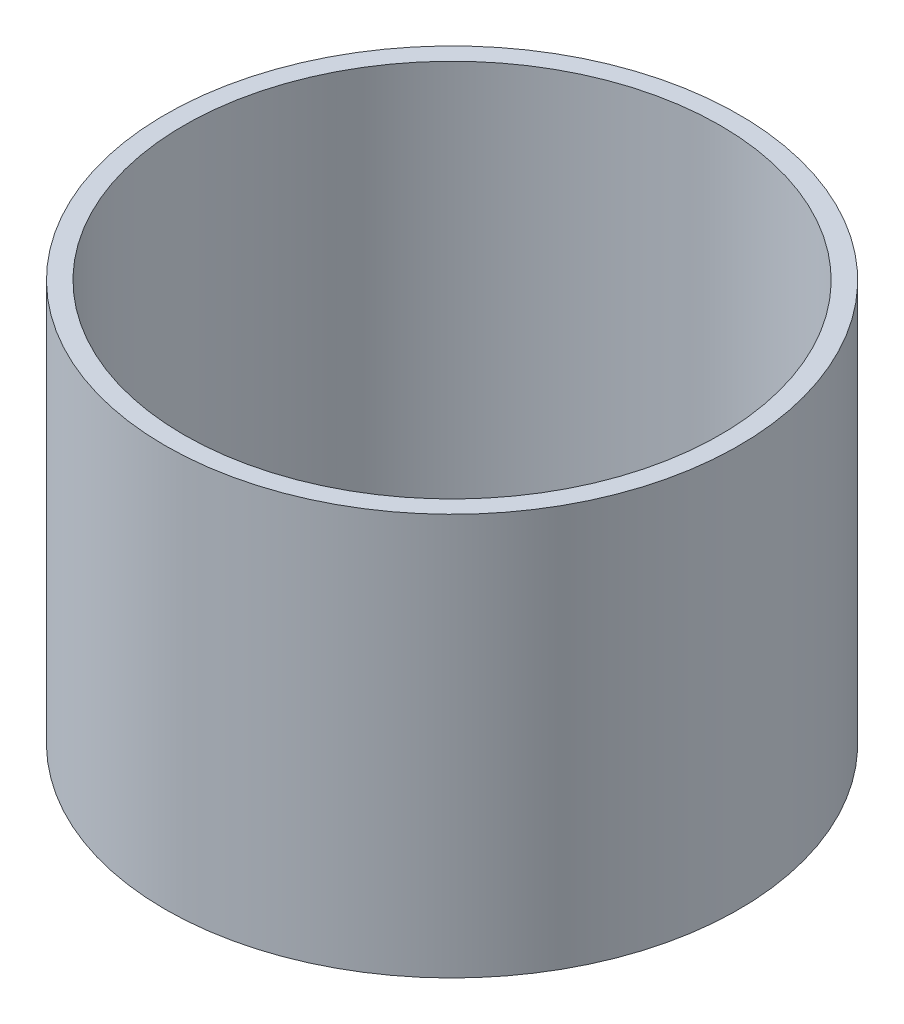
from build123d import *

# Parameters (mm, degrees)
SKETCH1_R           = 40.8178
SKETCH1_R_2         = 38.1508
BOSS_EXTRUDE1_DEPTH = 57.15


with BuildPart() as part:
    # Sketch1 → Boss-Extrude1 (new body)
    with BuildSketch(Plane(origin=(0, 0, 0), x_dir=(1, 0, 0), z_dir=(0, 1, 0))):
        Circle(SKETCH1_R)
        Circle(SKETCH1_R_2, mode=Mode.SUBTRACT)
    extrude(amount=BOSS_EXTRUDE1_DEPTH)


solid = part.part
